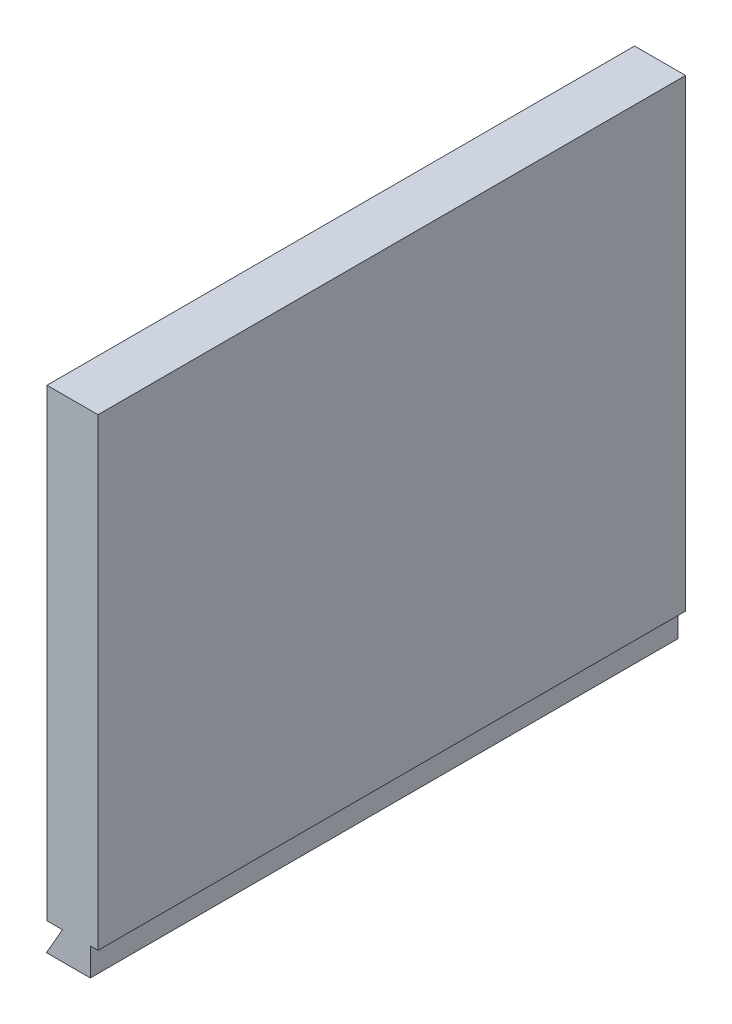
from build123d import *

# Parameters (mm, degrees)
BOSS_EXTRUDE1_DEPTH = 38


with BuildPart() as part:
    # Sketch1 → Boss-Extrude1 (new body)
    with BuildSketch(Plane.XY):
        Polygon((0, 0), (-1, 0), (-1, 30), (2.3, 30), (2.3, 0), (1.8, 0), (1.8, -1.8), (-1.039230485, -1.8), align=None)
    extrude(amount=BOSS_EXTRUDE1_DEPTH)


solid = part.part
